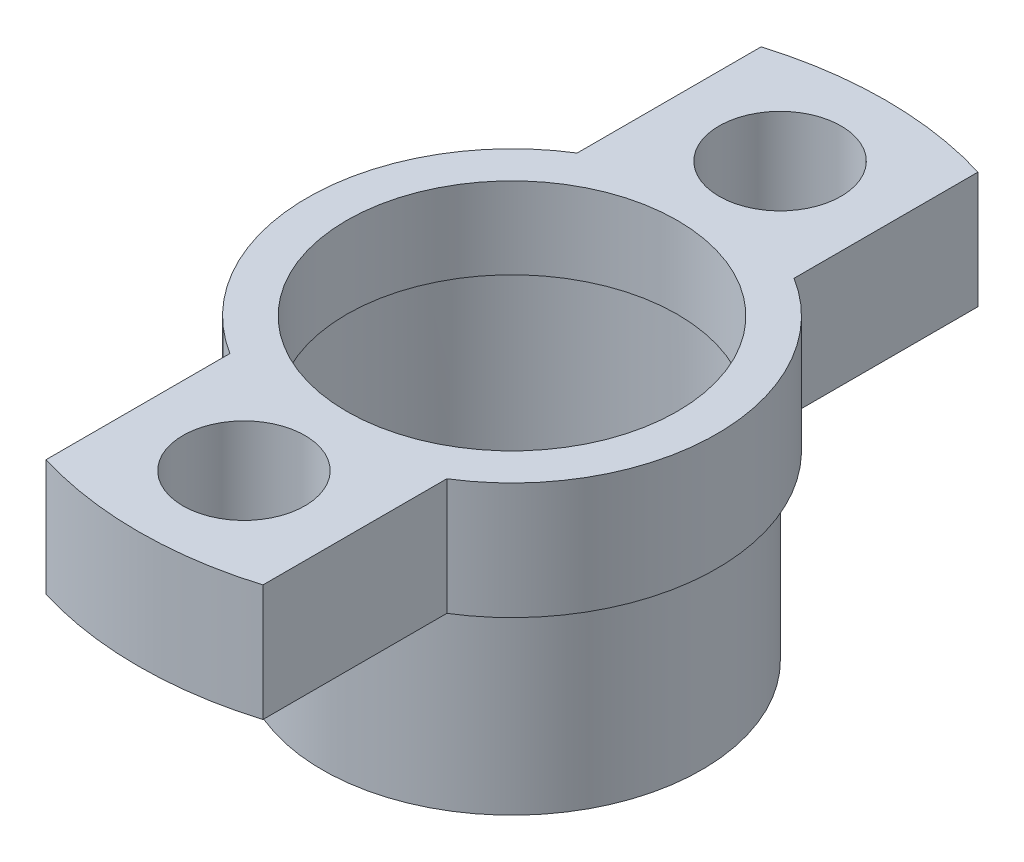
from build123d import *
from build123d.topology import SkipClean

# Parameters (mm, degrees)
SKETCH2_R                              = 6.55
SKETCH2_R_2                            = 5.8
MIDDLE_CORE_DEPTH                      = 6
ARMS_INSERT_FIXING_START               = -4.3
SKETCH3_R                              = 2.25
SKETCH3_R_2                            = 5.8
ARMS_INSERT_FIXING_TO_GUIDE_PART_DEPTH = 4.3
BOSS_EXTRU_1_REACH                     = 18.395
ESQUISSE2_R                            = 7.55
ESQUISSE2_R_2                          = 6.55
BOSS_EXTRU_2_START                     = 6
ESQUISSE3_R                            = 7.55
ESQUISSE3_R_2                          = 6.65
BOSS_EXTRU_2_DEPTH                     = 6
ESQUISSE4_R                            = 2.75
ENL_V_MAT_EXTRU_2_DEPTH                = 4
SKETCH26_R                             = 7.55
SKETCH26_R_2                           = 6.65
BOSS_EXTRUDE4_DEPTH                    = 6.7
SKETCH27_R                             = 7.55
SKETCH27_R_2                           = 7
CUT_EXTRUDE3_DEPTH                     = 6.7
SKETCH28_R                             = 6.65
CUT_EXTRUDE5_DEPTH                     = 30
BOSS_EXTRUDE5_START                    = -3
SKETCH29_R                             = 6.65
SKETCH29_R_2                           = 5.6
BOSS_EXTRUDE5_DEPTH                    = 3
SKETCH30_R                             = 5.65
CUT_EXTRUDE6_DEPTH                     = 12
SKETCH31_R                             = 5.675
CUT_EXTRUDE7_DEPTH                     = 10
SKETCH34_R                             = 6.1
CUT_EXTRUDE9_DEPTH                     = 10


with BuildPart() as part:
    # Sketch2 → Middle-core (new body)
    with BuildSketch(Plane(origin=(0, 0, 0), x_dir=(1, 0, 0), z_dir=(0, 1, 0))):
        with Locations(Location((0, 0, 0), (0, 0, 270))):
            Circle(SKETCH2_R)
        with Locations(Location((0, 0, 0), (0, 0, 270))):
            Circle(SKETCH2_R_2, mode=Mode.SUBTRACT)
    extrude(amount=MIDDLE_CORE_DEPTH)

    # Sketch3 → Arms_insert-Fixing to guide part (add)
    with SkipClean():  # the faces are left unmerged after this step: merging them gives an invalid solid
        with BuildSketch(Plane(origin=(0, 5, 0), x_dir=(1, 0, 0), z_dir=(0, 1, 0)).offset(ARMS_INSERT_FIXING_START)):
            with BuildLine():
                Line((-4, 5.186761996), (-4, 13.186761996))
                ThreePointArc((-4, 13.186761996), (0, 13.780083161), (4, 13.186761996))
                Line((4, 13.186761996), (4, 5.186761996))
                ThreePointArc((4, 5.186761996), (6.55, 0), (4, -5.186761996))
                Line((4, -5.186761996), (4, -13.186761996))
                ThreePointArc((4, -13.186761996), (0, -13.780083161), (-4, -13.186761996))
                Line((-4, -13.186761996), (-4, -5.186761996))
                ThreePointArc((-4, -5.186761996), (-6.55, 0), (-4, 5.186761996))
            make_face()
            with Locations(Location((0, 9.886761996, 0), (0, 0, 270))):
                Circle(SKETCH3_R, mode=Mode.SUBTRACT)
            with Locations(Location((0, 0, 0), (0, 0, 270))):
                Circle(SKETCH3_R_2, mode=Mode.SUBTRACT)
            with Locations(Location((0, -9.886761996, 0), (0, 0, 270))):
                Circle(SKETCH3_R, mode=Mode.SUBTRACT)
        extrude(amount=ARMS_INSERT_FIXING_TO_GUIDE_PART_DEPTH)

    # Boss.-Extru.1: up to this face of the body (flat: up to its plane)
    boss_extru_1_end = Plane(part.part.faces().sort_by_distance((0, 5, -6.667407482))[0])
    # Esquisse2 → Boss.-Extru.1 (add, up to the picked face)
    with BuildSketch(Plane.XZ, mode=Mode.PRIVATE) as boss_extru_1_sk1:
        with Locations(Location((0, 0, 0), (0, 0, 270))):
            Circle(ESQUISSE2_R)
        with Locations(Location((0, 0, 0), (0, 0, 270))):
            Circle(ESQUISSE2_R_2, mode=Mode.SUBTRACT)
    boss_extru_1_tool1 = split(extrude(boss_extru_1_sk1.sketch, amount=-BOSS_EXTRU_1_REACH, mode=Mode.PRIVATE), bisect_by=boss_extru_1_end, keep=Keep.BOTH, mode=Mode.PRIVATE)
    add(boss_extru_1_tool1.solids().sort_by(Axis((0, 0, 7.336454), (0, 1, 0)))[0])

    # Esquisse3 → Boss.-Extru.2 (add)
    with BuildSketch(Plane.XZ.offset(BOSS_EXTRU_2_START)):
        with Locations(Location((0, 0, 0), (0, 0, 270))):
            Circle(ESQUISSE3_R)
        with Locations(Location((0, 0, 0), (0, 0, 270))):
            Circle(ESQUISSE3_R_2, mode=Mode.SUBTRACT)
    extrude(amount=-BOSS_EXTRU_2_DEPTH)

    # Esquisse4 → Enlèv. mat.-Extru.2 (cut)
    with BuildSketch(Plane.XZ.offset(-0.7)):
        with Locations((0, -9.886761996)):
            Circle(ESQUISSE4_R)
        with Locations((0, 9.886761996)):
            Circle(ESQUISSE4_R)
    extrude(amount=ENL_V_MAT_EXTRU_2_DEPTH, mode=Mode.SUBTRACT)

    # Sketch26 → Boss-Extrude4 (add)
    with BuildSketch(Plane.XZ.offset(6)):
        with Locations(Location((0, 0, 0), (0, 0, 270))):
            Circle(SKETCH26_R)
        with Locations(Location((0, 0, 0), (0, 0, 270))):
            Circle(SKETCH26_R_2, mode=Mode.SUBTRACT)
    extrude(amount=-BOSS_EXTRUDE4_DEPTH)

    # Sketch27 → Cut-Extrude3 (cut)
    with BuildSketch(Plane.XZ.offset(6)):
        Circle(SKETCH27_R)
        with Locations(Location((0, 0, 0), (0, 0, 270))):
            Circle(SKETCH27_R_2, mode=Mode.SUBTRACT)
    extrude(amount=-CUT_EXTRUDE3_DEPTH, mode=Mode.SUBTRACT)

    # Sketch28 → Cut-Extrude5 (cut)
    with BuildSketch(Plane.XZ.offset(6)):
        with Locations(Location((0, 0, 0), (0, 0, 270))):
            Circle(SKETCH28_R)
    extrude(amount=-CUT_EXTRUDE5_DEPTH, mode=Mode.SUBTRACT)

    # Sketch29 → Boss-Extrude5 (add)
    with BuildSketch(Plane(origin=(0, 5, 0), x_dir=(1, 0, 0), z_dir=(0, 1, 0)).offset(BOSS_EXTRUDE5_START)):
        with Locations(Location((0, 0, 0), (0, 0, 270))):
            Circle(SKETCH29_R)
        with Locations(Location((0, 0, 0), (0, 0, 270))):
            Circle(SKETCH29_R_2, mode=Mode.SUBTRACT)
    extrude(amount=BOSS_EXTRUDE5_DEPTH)

    # Sketch30 → Cut-Extrude6 (cut)
    with BuildSketch(Plane(origin=(0, 5, 0), x_dir=(1, 0, 0), z_dir=(0, 1, 0))):
        with Locations(Location((0, 0, 0), (0, 0, 270))):
            Circle(SKETCH30_R)
    extrude(amount=-CUT_EXTRUDE6_DEPTH, mode=Mode.SUBTRACT)

    # Sketch31 → Cut-Extrude7 (cut)
    with BuildSketch(Plane.XZ.offset(-2)):
        with Locations(Location((0, 0, 0), (0, 0, 270))):
            Circle(SKETCH31_R)
    extrude(amount=-CUT_EXTRUDE7_DEPTH, mode=Mode.SUBTRACT)

    # Sketch34 → Cut-Extrude9 (cut)
    with BuildSketch(Plane(origin=(0, 5, 0), x_dir=(1, 0, 0), z_dir=(0, 1, 0))):
        with Locations(Location((0, 0, 0), (0, 0, 270))):
            Circle(SKETCH34_R)
    extrude(amount=-CUT_EXTRUDE9_DEPTH, mode=Mode.SUBTRACT)


solid = part.part
